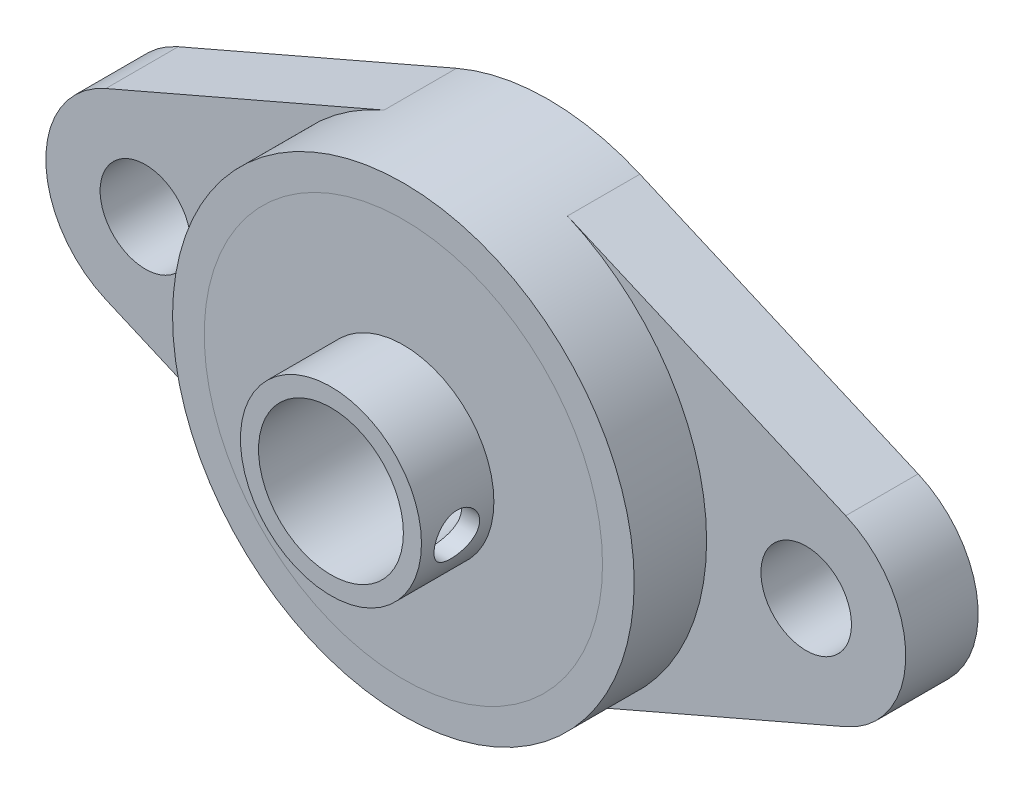
from build123d import *

# Parameters (mm, degrees)
CROQUIS1_R              = 5
CROQUIS1_R_2            = 2.5
SALIENTE_EXTRUIR1_DEPTH = 4
CROQUIS2_R              = 12.75
CROQUIS2_R_2            = 11
SALIENTE_EXTRUIR2_DEPTH = 4
CROQUIS3_R              = 11
CROQUIS3_R_2            = 5
SALIENTE_EXTRUIR3_DEPTH = 4
CROQUIS5_R              = 5
CROQUIS5_R_2            = 4
SALIENTE_EXTRUIR4_DEPTH = 12


with BuildPart() as part:
    # Croquis1 → Saliente-Extruir1 (new body)
    with BuildSketch(Plane.XY):
        with BuildLine():
            Line((-20.434931507, -5.047382917), (-5.065068493, -11.700751307))
            ThreePointArc((-5.065068493, -11.700751307), (0, -12.75), (5.065068493, -11.700751307))
            Line((5.065068493, -11.700751307), (20.434931507, -5.047382917))
            ThreePointArc((20.434931507, -5.047382917), (23.75, 0), (20.434931507, 5.047382917))
            Line((20.434931507, 5.047382917), (5.065068493, 11.700751307))
            ThreePointArc((5.065068493, 11.700751307), (0, 12.75), (-5.065068493, 11.700751307))
            Line((-5.065068493, 11.700751307), (-20.434931507, 5.047382917))
            ThreePointArc((-20.434931507, 5.047382917), (-23.75, 0), (-20.434931507, -5.047382917))
        make_face()
        Circle(CROQUIS1_R, mode=Mode.SUBTRACT)
        with Locations((-18.25, 0)):
            Circle(CROQUIS1_R_2, mode=Mode.SUBTRACT)
        with Locations((18.25, 0)):
            Circle(CROQUIS1_R_2, mode=Mode.SUBTRACT)
    extrude(amount=SALIENTE_EXTRUIR1_DEPTH)

    # Croquis2 → Saliente-Extruir2 (add)
    with BuildSketch(Plane.XY.offset(4)):
        with Locations(Location((0, 0, 0), (0, 0, 113.407016322))):
            Circle(CROQUIS2_R)
        Circle(CROQUIS2_R_2, mode=Mode.SUBTRACT)
    extrude(amount=SALIENTE_EXTRUIR2_DEPTH)


with BuildPart() as body_2:
    # Croquis3 → Saliente-Extruir3 (new body)
    with BuildSketch(Plane.XY.offset(4)):
        Circle(CROQUIS3_R)
        Circle(CROQUIS3_R_2, mode=Mode.SUBTRACT)
    extrude(amount=SALIENTE_EXTRUIR3_DEPTH)


with BuildPart() as body_3:
    # Croquis5 → Saliente-Extruir4 (new body)
    with BuildSketch(Plane.XY):
        Circle(CROQUIS5_R)
        Circle(CROQUIS5_R_2, mode=Mode.SUBTRACT)
    extrude(amount=SALIENTE_EXTRUIR4_DEPTH)


with BuildPart() as body_2_1:
    add(body_2.part)

    # Combinar1: union body 3
    add(body_3.part)

    # Sketch2 → M3 Tapped Hole1 (revolve, cut)
    with BuildSketch(Plane(origin=(5, -0.671278383, 10), x_dir=(0, 0, -1), z_dir=(0, 1, 0))):
        Polygon((0, 0), (0, 6.251075774), (1.25, 5.5), (1.25, 0), align=None)
    revolve(axis=Axis((11.35, -0.671278383, 10), (-1, 0, 0)), mode=Mode.SUBTRACT)


solid = Compound([part.part, body_2_1.part])
